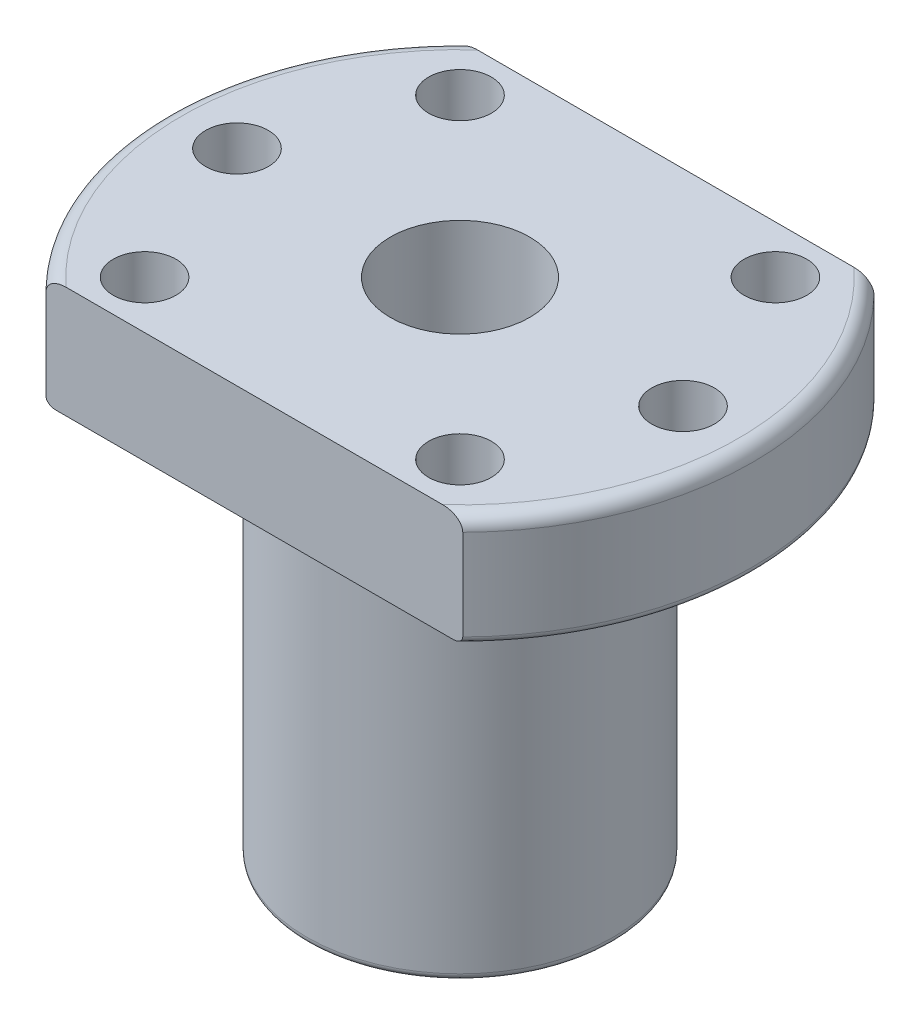
from build123d import *
from build123d.topology import SkipClean

# Parameters (mm, degrees)
SKETCH1_R            = 5
BOSS_EXTRUDE1_DEPTH  = 8
BOSS_EXTRUDE2_START  = 28
SKETCH2_R            = 11
SKETCH2_R_2          = 5
BOSS_EXTRUDE2_DEPTH  = 28
M4_CLEARANCE_HOLE1_D = 4.5
CIRPATTERN1_COUNT    = 8
FILLET1_R            = 1
FILLET2_R            = 0.5


with BuildPart() as part:
    # Sketch1 → Boss-Extrude1 (new body)
    with BuildSketch(Plane(origin=(0, 0, 0), x_dir=(1, 0, 0), z_dir=(0, 1, 0))):
        with BuildLine():
            Line((-14.947825929, 14.75), (14.947825929, 14.75))
            ThreePointArc((14.947825929, 14.75), (21, 0), (14.947825929, -14.75))
            Line((14.947825929, -14.75), (-14.947825929, -14.75))
            ThreePointArc((-14.947825929, -14.75), (-21, 0), (-14.947825929, 14.75))
        make_face()
        with Locations(Location((0, 0, 0), (0, 0, 270))):
            Circle(SKETCH1_R, mode=Mode.SUBTRACT)
    extrude(amount=BOSS_EXTRUDE1_DEPTH)

    # Sketch2 → Boss-Extrude2 (add)
    with SkipClean():  # the faces are left unmerged after this step: merging them gives an invalid solid
        with BuildSketch(Plane.XZ.offset(BOSS_EXTRUDE2_START)):
            with Locations(Location((0, 0, 0), (0, 0, 90))):
                Circle(SKETCH2_R)
            with Locations(Location((0, 0, 0), (0, 0, 270))):
                Circle(SKETCH2_R_2, mode=Mode.SUBTRACT)
        extrude(amount=-BOSS_EXTRUDE2_DEPTH)

    # M4 Clearance Hole1 (through all)
    with Locations(Plane(origin=(0, 8, 0), x_dir=(1, 0, 0), z_dir=(0, 1, 0))):
        with Locations((16, 0)):
            m4_clearance_hole1 = Hole(M4_CLEARANCE_HOLE1_D / 2)

    # CirPattern1: M4 Clearance Hole1 ×8 about axis, 2 skipped
    with SkipClean():  # the faces are left unmerged after this step: merging them gives an invalid solid
        cirpattern1_axis = Axis((0, 0, 0), (0, 1, 0))
        add([m4_clearance_hole1.rotate(cirpattern1_axis, i * 360 / CIRPATTERN1_COUNT) for i in range(1, CIRPATTERN1_COUNT) if i not in (2, 6)], mode=Mode.SUBTRACT)

    # Fillet1
    fillet1_edges = [part.edges().sort_by_distance(p)[0] for p in [
        (21, 8, 0),
        (-21, 8, 0),
    ]]
    fillet(fillet1_edges, radius=FILLET1_R)

    # Fillet2
    fillet2_edges = [part.edges().sort_by_distance(p)[0] for p in [
        (0, -28, -11),
        (21, 0, 0),
        (-21, 0, 0),
    ]]
    fillet(fillet2_edges, radius=FILLET2_R)


solid = part.part
